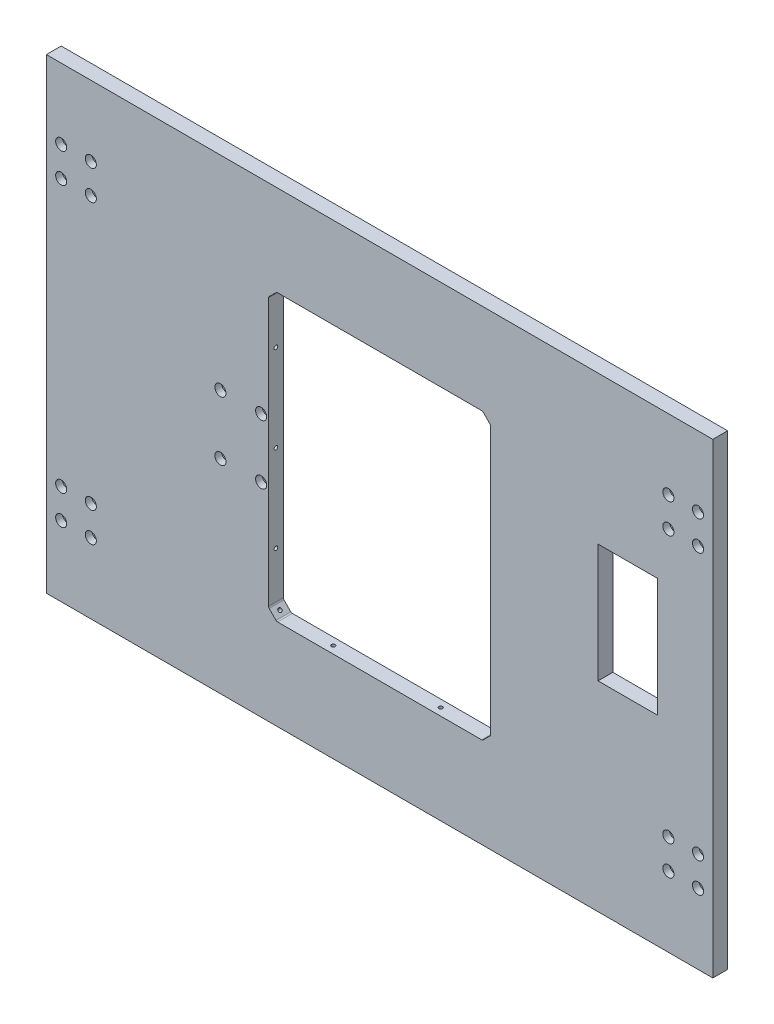
from build123d import *

# Parameters (mm, degrees)
SKETCH1_W                                            = 900
SKETCH1_H                                            = 630
BOSS_EXTRUDE1_DEPTH                                  = 20
SKETCH2_W                                            = 300
SKETCH2_H                                            = 385
CUT_EXTRUDE1_DEPTH                                   = 550.65898519
CHAMFER1_SIZE                                        = 11
FILLET1_R                                            = 3
M6_TAPPED_HOLE2_AT_2_COUNT                           = 2
M6_TAPPED_HOLE2_AT_2_PITCH                           = 117.5
CBORE_FOR_M8_HEXAGON_SOCKET_HEAD_CAP_SCR_D           = 8.4
CBORE_FOR_M8_HEXAGON_SOCKET_HEAD_CAP_SCR_CBORE_D     = 15
CBORE_FOR_M8_HEXAGON_SOCKET_HEAD_CAP_SCR_CBORE_DEPTH = 9
SKETCH13_W                                           = 80
SKETCH13_H                                           = 160
CUT_EXTRUDE3_DEPTH                                   = 550.65898519


with BuildPart() as part:
    # Sketch1 → Boss-Extrude1 (new body)
    with BuildSketch(Plane.XY):
        Rectangle(SKETCH1_W, SKETCH1_H)
    extrude(amount=BOSS_EXTRUDE1_DEPTH)

    # Sketch2 → Cut-Extrude1 (cut, through all)
    with BuildSketch(Plane.XY.offset(20)):
        Rectangle(SKETCH2_W, SKETCH2_H)
    extrude(amount=-CUT_EXTRUDE1_DEPTH, mode=Mode.SUBTRACT)

    # Chamfer1
    chamfer1_edges = [part.edges().sort_by_distance(p)[0] for p in [
        (-150, -192.5, 10),
        (-150, 192.5, 10),
        (150, 192.5, 10),
        (150, -192.5, 10),
    ]]
    chamfer(chamfer1_edges, length=CHAMFER1_SIZE)

    # Sketch4 → M6 Tapped Hole1 (revolve, cut)
    with BuildSketch(Plane(origin=(-144.5, 187, 10), x_dir=(0.7071067811865441, 0.7071067811865509, 0), z_dir=(0, 0, 1))):
        Polygon((0, 0), (0, 31.502151548), (2.5, 30), (2.5, 0), align=None)
    m6_tapped_hole1 = revolve(axis=Axis((-140.009871939, 182.509871939, 10), (-0.7071067811865509, 0.7071067811865442, 0)), mode=Mode.SUBTRACT)

    # Fillet1
    fillet1_edges = [part.edges().sort_by_distance(p)[0] for p in [
        (139, -192.5, 10),
        (-139, -192.5, 10),
        (-150, 181.5, 10),
        (-150, -181.5, 10),
        (150, 181.5, 10),
        (150, -181.5, 10),
        (-139, 192.5, 10),
        (139, 192.5, 10),
    ]]
    fillet(fillet1_edges, radius=FILLET1_R)

    # Sketch6 → M6 Tapped Hole2 (revolve, cut)
    with BuildSketch(Plane(origin=(-150, 0, 10), x_dir=(0, 0, -1), z_dir=(0, 1, 0))):
        Polygon((0, 0), (0, 31.502151548), (2.5, 30), (2.5, 0), align=None)
    m6_tapped_hole2 = revolve(axis=Axis((-143.65, 0, 10), (-1, 0, 0)), mode=Mode.SUBTRACT)

    # M6 Tapped Hole2 at 2: M6 Tapped Hole2 ×2
    with Locations(*[(0, i * M6_TAPPED_HOLE2_AT_2_PITCH, 0) for i in range(1, M6_TAPPED_HOLE2_AT_2_COUNT)]):
        add(m6_tapped_hole2, mode=Mode.SUBTRACT)

    # Sketch8 → M6 Tapped Hole3 (revolve, cut)
    with BuildSketch(Plane(origin=(-72.5, 192.5, 10), x_dir=(0, 0, -1), z_dir=(1, 0, 0))):
        Polygon((0, 0), (0, 31.502151548), (2.5, 30), (2.5, 0), align=None)
    m6_tapped_hole3 = revolve(axis=Axis((-72.5, 186.15, 10), (0, 1, 0)), mode=Mode.SUBTRACT)

    # Mirror1: M6 Tapped Hole1, M6 Tapped Hole2, M6 Tapped Hole3 across plane
    add(m6_tapped_hole1.mirror(Plane(origin=(0, 0, 0), x_dir=(0, 0, 1), z_dir=(1, 0, 0))), mode=Mode.SUBTRACT)
    add(m6_tapped_hole2.mirror(Plane(origin=(0, 0, 0), x_dir=(0, 0, 1), z_dir=(1, 0, 0))), mode=Mode.SUBTRACT)
    add(m6_tapped_hole3.mirror(Plane(origin=(0, 0, 0), x_dir=(0, 0, 1), z_dir=(1, 0, 0))), mode=Mode.SUBTRACT)

    # Mirror1 copy 1 sketch → Mirror1 copy 1 (revolve, cut)
    with BuildSketch(Plane(origin=(150, 117.5, 10), x_dir=(0, 0, -1), z_dir=(0, 1, 0))):
        Polygon((0, 0), (0, -31.502151548), (2.5, -30), (2.5, 0), align=None)
    revolve(axis=Axis((143.65, 117.5, 10), (-1, 0, 0)), mode=Mode.SUBTRACT)

    # Mirror1 at the second plane: M6 Tapped Hole1, M6 Tapped Hole2, M6 Tapped Hole3 across plane
    add(m6_tapped_hole1.mirror(Plane.ZX), mode=Mode.SUBTRACT)
    add(m6_tapped_hole2.mirror(Plane.ZX), mode=Mode.SUBTRACT)
    add(m6_tapped_hole3.mirror(Plane.ZX), mode=Mode.SUBTRACT)

    # Mirror1 at the second plane copy 1 sketc → Mirror1 at the second plane copy 1 (revolve, cut)
    with BuildSketch(Plane(origin=(-150, -117.5, 10), x_dir=(0, 0, -1), z_dir=(0, -1, 0))):
        Polygon((0, 0), (0, -31.502151548), (2.5, -30), (2.5, 0), align=None)
    revolve(axis=Axis((-143.65, -117.5, 10), (1, 0, 0)), mode=Mode.SUBTRACT)

    # Mirror1 at the second plane copy 2 sketc → Mirror1 at the second plane copy 2 (revolve, cut)
    with BuildSketch(Plane(origin=(144.5, -187, 10), x_dir=(-0.7071067811865441, -0.7071067811865509, 0), z_dir=(0, 0, 1))):
        Polygon((0, 0), (0, 31.502151548), (2.5, 30), (2.5, 0), align=None)
    revolve(axis=Axis((140.009871939, -182.509871939, 10), (0.7071067811865509, -0.7071067811865442, 0)), mode=Mode.SUBTRACT)

    # Mirror1 at the second plane copy 3 sketc → Mirror1 at the second plane copy 3 (revolve, cut)
    with BuildSketch(Plane(origin=(150, 0, 10), x_dir=(0, 0, -1), z_dir=(0, -1, 0))):
        Polygon((0, 0), (0, 31.502151548), (2.5, 30), (2.5, 0), align=None)
    revolve(axis=Axis((143.65, 0, 10), (1, 0, 0)), mode=Mode.SUBTRACT)

    # Mirror1 at the second plane copy 4 sketc → Mirror1 at the second plane copy 4 (revolve, cut)
    with BuildSketch(Plane(origin=(72.5, -192.5, 10), x_dir=(0, 0, -1), z_dir=(-1, 0, 0))):
        Polygon((0, 0), (0, 31.502151548), (2.5, 30), (2.5, 0), align=None)
    revolve(axis=Axis((72.5, -186.15, 10), (0, -1, 0)), mode=Mode.SUBTRACT)

    # Mirror1 at the second plane copy 5 sketc → Mirror1 at the second plane copy 5 (revolve, cut)
    with BuildSketch(Plane(origin=(150, -117.5, 10), x_dir=(0, 0, -1), z_dir=(0, -1, 0))):
        Polygon((0, 0), (0, 31.502151548), (2.5, 30), (2.5, 0), align=None)
    revolve(axis=Axis((143.65, -117.5, 10), (1, 0, 0)), mode=Mode.SUBTRACT)

    # CBORE for M8 Hexagon socket head cap screws1 (through all)
    with Locations(Plane.XY.offset(20)):
        with Locations((-430, 220), (-390, 220), (-430, 180), (-390, 180), (-215.00186624, 40), (-160.00186624, 40), (390, 220), (430, 220), (390, 180), (430, 180), (430, -180), (390, -180), (430, -220), (390, -220), (-160.00186624, -40), (-215.00186624, -40), (-390, -180), (-430, -180), (-390, -220), (-430, -220)):
            CounterBoreHole(CBORE_FOR_M8_HEXAGON_SOCKET_HEAD_CAP_SCR_D / 2, CBORE_FOR_M8_HEXAGON_SOCKET_HEAD_CAP_SCR_CBORE_D / 2, CBORE_FOR_M8_HEXAGON_SOCKET_HEAD_CAP_SCR_CBORE_DEPTH)

    # Sketch13 → Cut-Extrude3 (cut, through all)
    with BuildSketch(Plane.XY.offset(20)):
        with Locations((335, 35)):
            Rectangle(SKETCH13_W, SKETCH13_H)
    extrude(amount=-CUT_EXTRUDE3_DEPTH, mode=Mode.SUBTRACT)


solid = part.part
